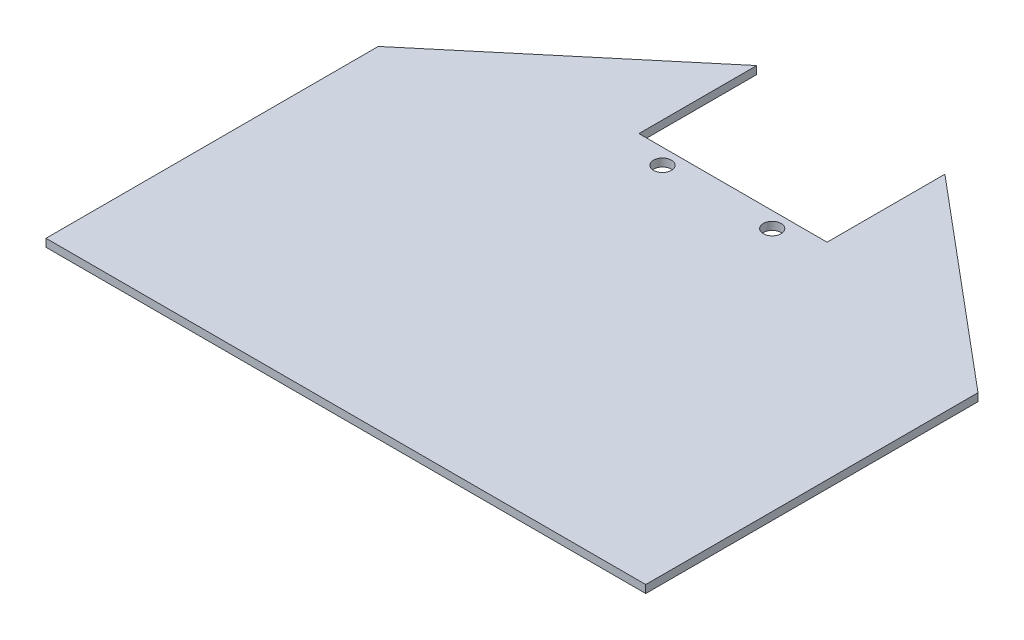
from build123d import *

# Parameters (mm, degrees)
EXTRUDE_1_DEPTH     = 2
SKETCH_2_W          = 48
SKETCH_2_H          = 50.191121785
CUT_EXTRUDE_1_DEPTH = 10
SKETCH_3_R          = 2.275
CUT_EXTRUDE_2_DEPTH = 10


with BuildPart() as part:
    # 草图1 → 凸台-拉伸1 (new body)
    with BuildSketch(Plane(origin=(0, 0, 0), x_dir=(1, 0, 0), z_dir=(0, 1, 0))):
        Polygon((-76.5, 42.382061447), (0, 106.573183232), (76.5, 42.382061447), (76.5, -42.382061447), (-76.5, -42.382061447), align=None)
    extrude(amount=EXTRUDE_1_DEPTH)

    # 草图2 → 切除-拉伸1 (cut)
    with BuildSketch(Plane(origin=(0, 2, 0), x_dir=(1, 0, 0), z_dir=(0, 1, 0))):
        with Locations((0, 81.47762234)):
            Rectangle(SKETCH_2_W, SKETCH_2_H)
    extrude(amount=-CUT_EXTRUDE_1_DEPTH, mode=Mode.SUBTRACT)

    # 草图3 → 切除-拉伸2 (cut)
    with BuildSketch(Plane(origin=(0, 2, 0), x_dir=(1, 0, 0), z_dir=(0, 1, 0))):
        with Locations(Location((14, 52.382061447, 0), (0, 0, 270))):
            Circle(SKETCH_3_R)
        with Locations(Location((-14, 52.382061447, 0), (0, 0, 270))):
            Circle(SKETCH_3_R)
    extrude(amount=-CUT_EXTRUDE_2_DEPTH, mode=Mode.SUBTRACT)


solid = part.part
